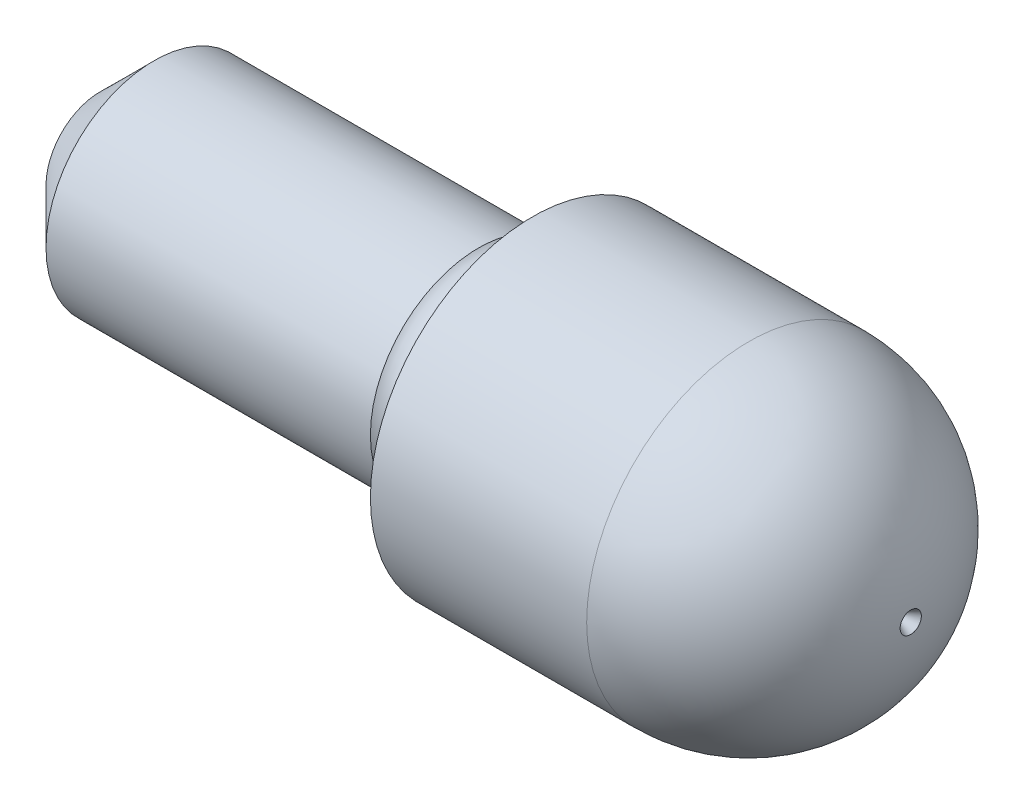
from build123d import *


with BuildPart() as part:
    # Sketch1 → Revolve1 (revolve)
    with BuildSketch(Plane(origin=(0, 0, 0), x_dir=(-1, 0, 0), z_dir=(0, 0, -1)), mode=Mode.PRIVATE) as revolve1_sk:
        with BuildLine():
            Line((-3.49678579, 0.098144275), (-3.326794919, 0))
            Line((-3.326794919, 0), (3.826794919, 0))
            Line((3.826794919, 0), (4, 0.1))
            Line((4, 0.1), (4, 0.5))
            Line((4, 0.5), (3.5, 1))
            Line((3.5, 1), (0.5, 1))
            ThreePointArc((0.5, 1), (0.438423113, 0.962917131), (0.367712434, 0.95))
            Line((0.367712434, 0.95), (0.2, 0.95))
            ThreePointArc((0.2, 0.95), (0.058578644, 1.008578644), (0, 1.15))
            Line((0, 1.15), (0, 1.5))
            Line((0, 1.5), (-2, 1.5))
            ThreePointArc((-2, 1.5), (-3.025373978, 1.094809667), (-3.49678579, 0.098144275))
        make_face()
    revolve(revolve1_sk.sketch.rotate(Axis((3.501542885, 0, 0), (-1, 0, 0)), 270), axis=Axis((3.501542885, 0, 0), (-1, 0, 0)))


solid = part.part
